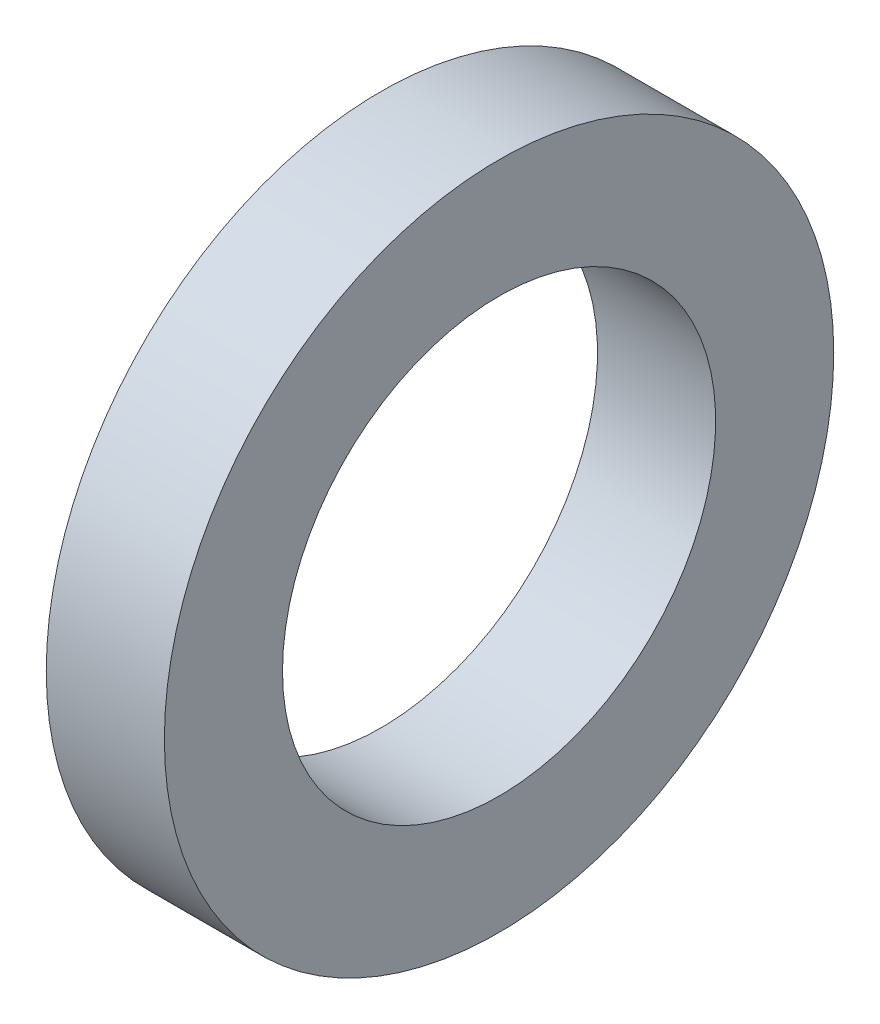
from build123d import *

# Parameters (mm, degrees)
SKETCH1_W = 1.5
SKETCH1_H = 1.5


with BuildPart() as part:
    # Sketch1 → Revolve1 (revolve)
    with BuildSketch(Plane.XY, mode=Mode.PRIVATE) as revolve1_sk:
        with Locations((0.75, 3.5)):
            Rectangle(SKETCH1_W, SKETCH1_H)
    revolve(revolve1_sk.sketch.rotate(Axis((0, 0, 0), (1, 0, 0)), 90), axis=Axis((0, 0, 0), (1, 0, 0)))


solid = part.part
